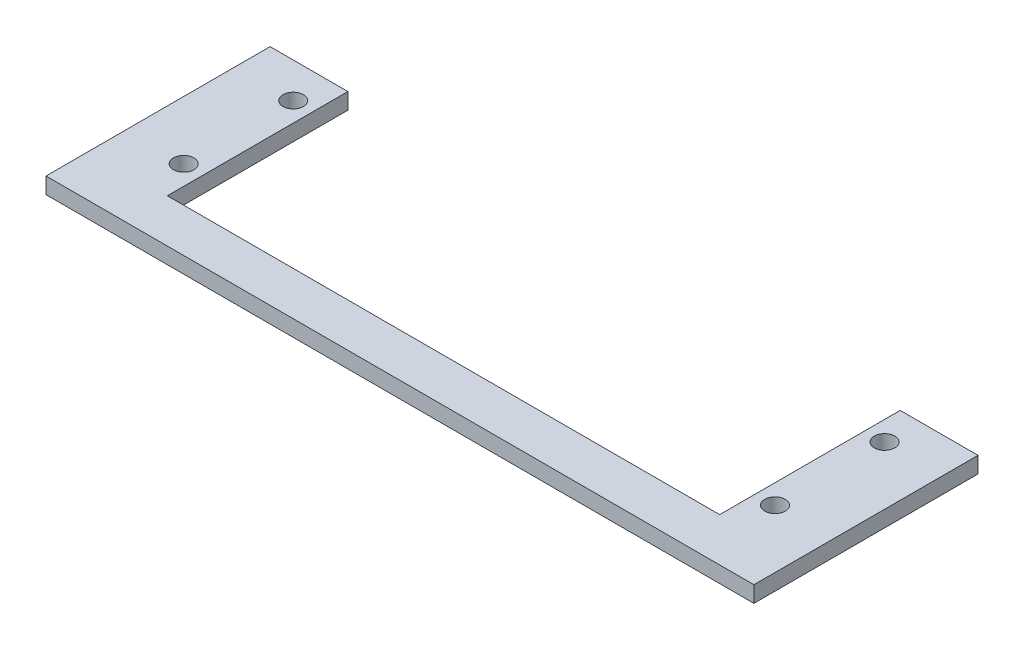
from build123d import *

# Parameters (mm, degrees)
SKETCH2_R           = 1.65
BOSS_EXTRUDE1_DEPTH = 2.6


with BuildPart() as part:
    # Sketch2 → Boss-Extrude1 (new body)
    with BuildSketch(Plane(origin=(0, 0, 0), x_dir=(1, 0, 0), z_dir=(0, 1, 0))):
        Polygon((-44.365, 0), (-44.365, -29), (44.365, -29), (44.365, 0), (56.865, 0), (56.865, -36), (-56.865, -36), (-56.865, 0), align=None)
        with Locations(Location((-47.5, -5.65, 0), (0, 0, 270))):
            Circle(SKETCH2_R, mode=Mode.SUBTRACT)
        with Locations(Location((47.5, -5.65, 0), (0, 0, 270))):
            Circle(SKETCH2_R, mode=Mode.SUBTRACT)
        with Locations(Location((-47.5, -23.25, 0), (0, 0, 270))):
            Circle(SKETCH2_R, mode=Mode.SUBTRACT)
        with Locations(Location((47.5, -23.25, 0), (0, 0, 270))):
            Circle(SKETCH2_R, mode=Mode.SUBTRACT)
    extrude(amount=BOSS_EXTRUDE1_DEPTH)


solid = part.part
